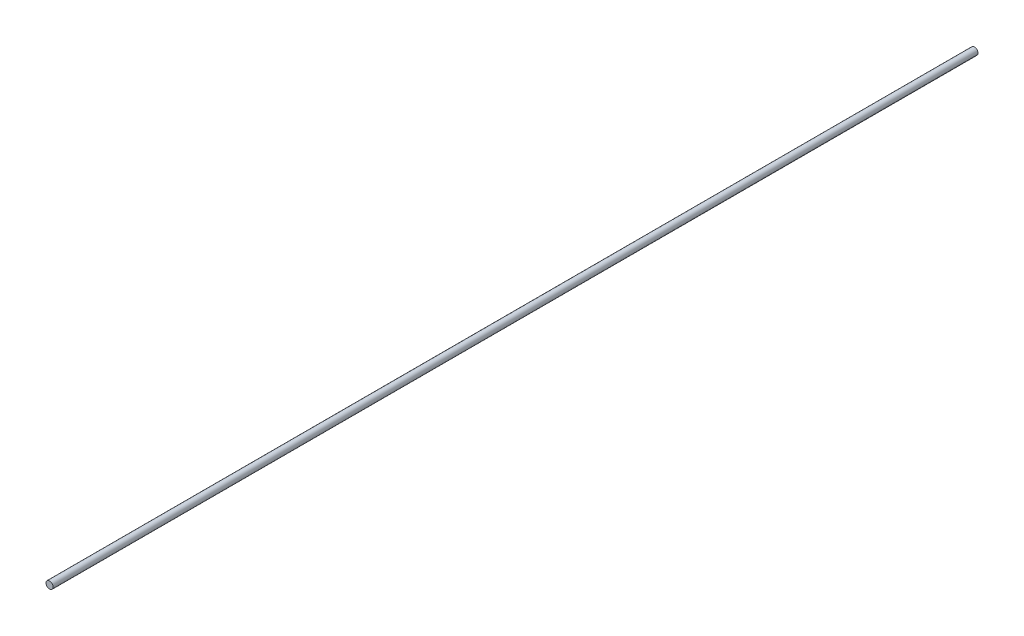
from build123d import *

# Parameters (mm, degrees)
SKETCH1_R = 2.5
ROD_DEPTH = 652


with BuildPart() as part:
    # Sketch1 → Rod (new body)
    with BuildSketch(Plane.XY):
        Circle(SKETCH1_R)
    extrude(amount=ROD_DEPTH)


solid = part.part
